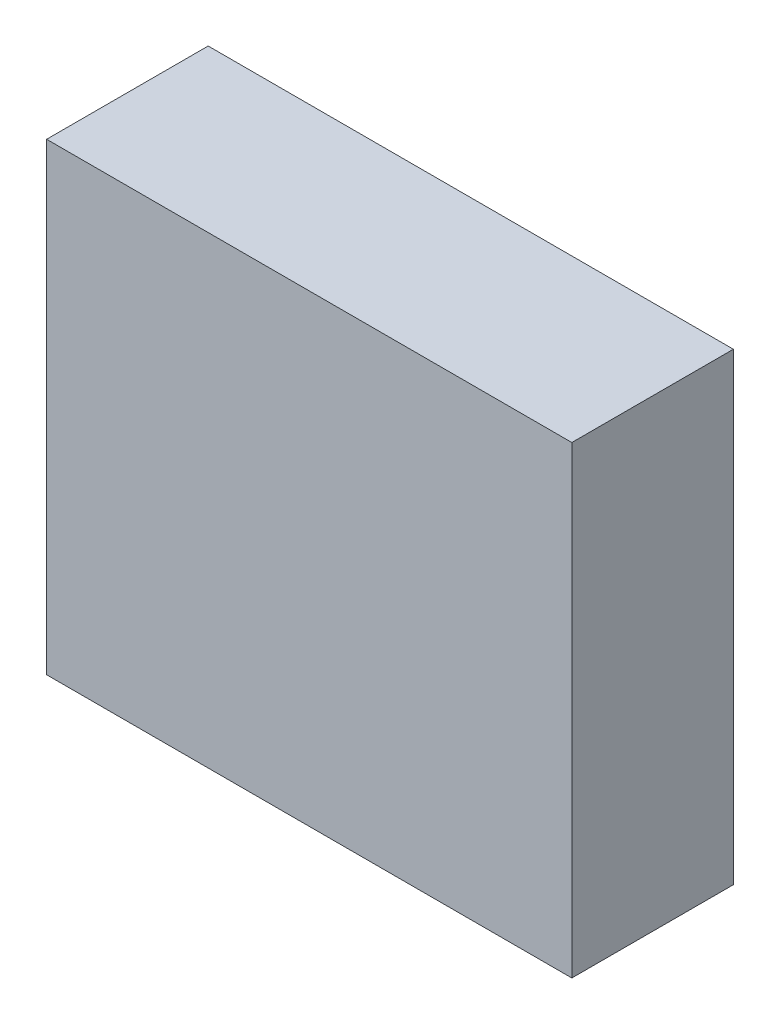
from build123d import *

# Parameters (mm, degrees)
SKETCH1_W               = 3.2512
SKETCH1_H               = 2.870803
COMPONENT_OUTLINE_DEPTH = 1


with BuildPart() as part:
    # Sketch1 → Component_Outline (new body)
    with BuildSketch(Plane.XY):
        with Locations((0, -0.1146015)):
            Rectangle(SKETCH1_W, SKETCH1_H)
    extrude(amount=COMPONENT_OUTLINE_DEPTH)


solid = part.part
